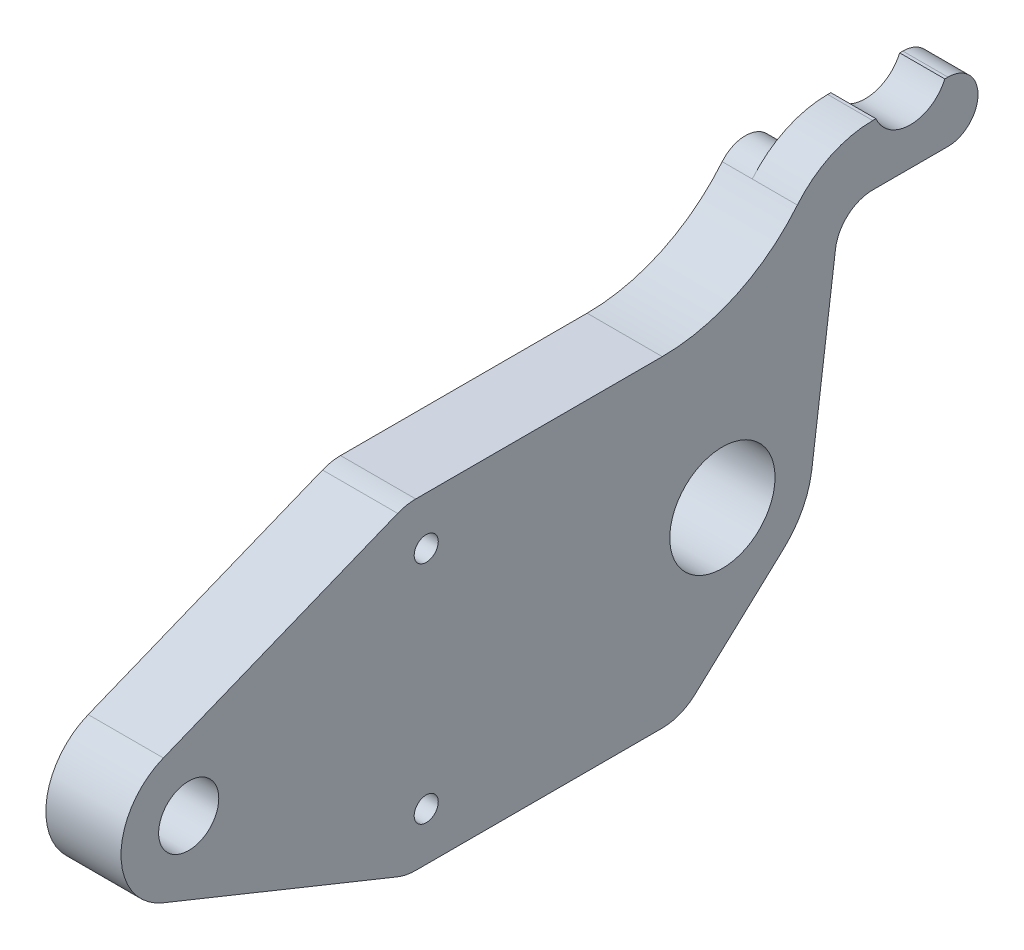
from build123d import *

# Parameters (mm, degrees)
ESQUISSE1_W             = 5
ESQUISSE1_H             = 28
EXTRUSION1_DEPTH        = 46
ESQUISSE2_R             = 2
ESQUISSE2_R_2           = 3.5
EXTRUSION2_DEPTH        = 49.342527861
TROU_TARAUD_M21_D       = 1.6
BOSS_EXTRU_2_DEPTH      = 5
ENL_V_MAT_EXTRU_1_DEPTH = 10
ENL_V_START             = 3
ENL_V_MAT_EXTRU_2_DEPTH = 56.9067059


with BuildPart() as part:
    # Esquisse1 → Extrusion1 (new body)
    with BuildSketch(Plane.XY):
        Rectangle(ESQUISSE1_W, ESQUISSE1_H)
    extrude(amount=-EXTRUSION1_DEPTH)

    # Esquisse2 → Extrusion2 (cut, through all)
    with BuildSketch(Plane(origin=(2.5, 0, 0), x_dir=(0, 0, -1), z_dir=(1, 0, 0))):
        with Locations((4.5, -3.3)):
            Circle(ESQUISSE2_R)
        with Locations((40, -3.3)):
            Circle(ESQUISSE2_R_2)
    extrude(amount=-EXTRUSION2_DEPTH, mode=Mode.SUBTRACT)

    # Trou taraudé M21 (through all)
    with Locations(Plane(origin=(2.5, 0, 0), x_dir=(0, 0, -1), z_dir=(1, 0, 0))):
        with Locations((20.3, 4.2), (20.3, -10.8)):
            Hole(TROU_TARAUD_M21_D / 2)

    # Esquisse12 → Boss.-Extru.2 (add)
    with BuildSketch(Plane.ZY.offset(2.5)):
        with BuildLine():
            Line((-46, 14), (-50.208712153, 14))
            ThreePointArc((-50.208712153, 14), (-52.5, 12.5), (-54.791287847, 14))
            Line((-54.791287847, 14), (-55, 14))
            ThreePointArc((-55, 14), (-57, 12), (-55, 10))
            Line((-55, 10), (-50, 10))
            ThreePointArc((-50, 10), (-48.294604063, 9.328011132), (-47.506013794, 7.673299759))
            Line((-47.506013794, 7.673299759), (-46, -14))
            Line((-46, -14), (-46, 14))
        make_face()
    extrude(amount=-BOSS_EXTRU_2_DEPTH)

    # Esquisse13 → Enlèv. mat.-Extru.1 (cut)
    with BuildSketch(Plane.ZY.offset(2.5)):
        with BuildLine():
            ThreePointArc((-47.521517479, 7.82729863), (-47.512573575, 7.750419205), (-47.506013794, 7.673299759))
            Line((-47.506013794, 7.673299759), (-46, -14))
            Line((-46, -14), (-36, -14))
            ThreePointArc((-36, -14), (-37.164860583, -13.780452956), (-38.169882605, -13.151937389))
            Line((-38.169882605, -13.151937389), (-44.068529884, -7.709882605))
            ThreePointArc((-44.068529884, -7.709882605), (-45.326210473, -6.062513711), (-45.94835805, -4.085516713))
            Line((-45.94835805, -4.085516713), (-47.521517479, 7.82729863))
        make_face()
        with BuildLine():
            ThreePointArc((-18.401732057, -13.767179458), (-18.989661678, -13.941255662), (-19.6, -14))
            Line((-19.6, -14), (0, -14))
            Line((0, -14), (0, -3.3))
            ThreePointArc((0, -3.3), (-0.769531576, -5.81666552), (-2.814935705, -7.472596113))
            Line((-2.814935705, -7.472596113), (-18.401732057, -13.767179458))
        make_face()
        with BuildLine():
            ThreePointArc((-2.814935705, 0.872596113), (-0.769531576, -0.78333448), (0, -3.3))
            Line((0, -3.3), (0, 14))
            Line((0, 14), (-50, 14))
            ThreePointArc((-50, 14), (-47.228274994, 13.379416679), (-44.985807313, 11.636166305))
            ThreePointArc((-44.985807313, 11.636166305), (-40.96713796, 8.512131601), (-36, 7.4))
            Line((-36, 7.4), (-19.6, 7.4))
            ThreePointArc((-19.6, 7.4), (-18.989661678, 7.341255662), (-18.401732057, 7.167179458))
            Line((-18.401732057, 7.167179458), (-2.814935705, 0.872596113))
        make_face()
    extrude(amount=-ENL_V_MAT_EXTRU_1_DEPTH, mode=Mode.SUBTRACT)

    # Esquisse14 → Enlèv. mat.-Extru.2 (cut, through all)
    with BuildSketch(Plane.ZY.offset(-2.5).offset(ENL_V_START)):
        with BuildLine():
            ThreePointArc((-44.985807313, 11.636166305), (-47.228274994, 13.379416679), (-50, 14))
            Line((-50, 14), (-50.208712153, 14))
            ThreePointArc((-50.208712153, 14), (-52.5, 12.5), (-54.791287847, 14))
            Line((-54.791287847, 14), (-55, 14))
            ThreePointArc((-55, 14), (-57, 12), (-55, 10))
            Line((-55, 10), (-50, 10))
            ThreePointArc((-50, 10), (-48.933951921, 9.761314107), (-48.071464351, 9.090833194))
            ThreePointArc((-48.071464351, 9.090833194), (-47.801302388, 11.906328268), (-44.985807313, 11.636166305))
        make_face()
    extrude(amount=ENL_V_MAT_EXTRU_2_DEPTH, mode=Mode.SUBTRACT)


solid = part.part
